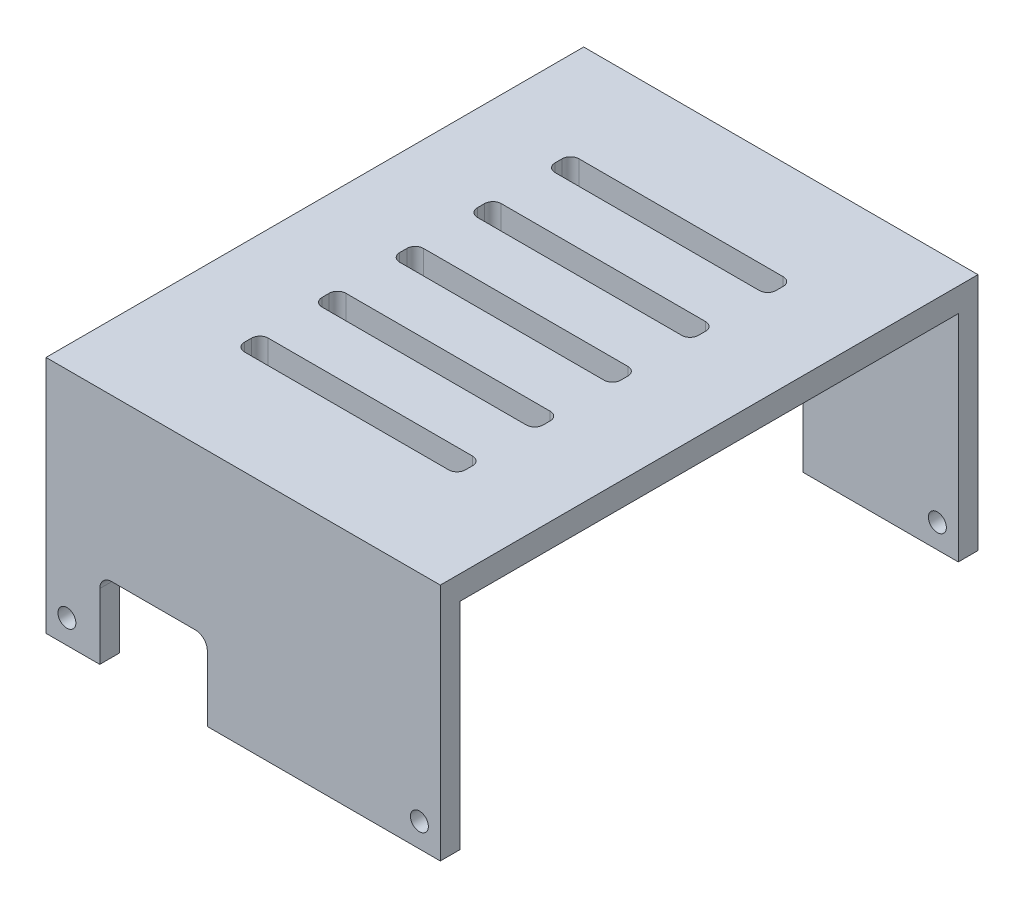
from build123d import *

# Parameters (mm, degrees)
SKETCH1_W           = 66
SKETCH1_H           = 4
BOSS_EXTRUDE1_DEPTH = 90
SKETCH2_W           = 66
SKETCH2_H           = 36
BOSS_EXTRUDE2_DEPTH = 3.3
SKETCH3_W           = 66
SKETCH3_H           = 36
BOSS_EXTRUDE3_DEPTH = 3.3
SKETCH4_R           = 1.5
CUT_EXTRUDE1_DEPTH  = 104.116439039
CUT_EXTRUDE2_REACH  = 105.116
SKETCH5_W           = 18
SKETCH5_H           = 13
CUT_EXTRUDE4_REACH  = 105.116
FILLET1_R           = 2
CUT_EXTRUDE5_REACH  = 105.87
LPATTERN1_COUNT     = 5
LPATTERN1_PITCH     = 13


with BuildPart() as part:
    # Sketch1 → Boss-Extrude1 (new body)
    with BuildSketch(Plane.XY):
        Rectangle(SKETCH1_W, SKETCH1_H)
    extrude(amount=BOSS_EXTRUDE1_DEPTH)

    # Sketch2 → Boss-Extrude2 (add)
    with BuildSketch(Plane.XY.offset(90)):
        with Locations((0, -20)):
            Rectangle(SKETCH2_W, SKETCH2_H)
    extrude(amount=-BOSS_EXTRUDE2_DEPTH)

    # Sketch3 → Boss-Extrude3 (add)
    with BuildSketch(Plane(origin=(0, 0, 0), x_dir=(-1, 0, 0), z_dir=(0, 0, -1))):
        with Locations((0, -20)):
            Rectangle(SKETCH3_W, SKETCH3_H)
    extrude(amount=-BOSS_EXTRUDE3_DEPTH)

    # Sketch4 → Cut-Extrude1 (cut, through all)
    with BuildSketch(Plane.XY.offset(90)):
        with Locations((-29.5, -34)):
            Circle(SKETCH4_R)
        with Locations((29.5, -34)):
            Circle(SKETCH4_R)
    extrude(amount=-CUT_EXTRUDE1_DEPTH, mode=Mode.SUBTRACT)

    # Sketch5 → Cut-Extrude2 (cut, up to next)
    with BuildSketch(Plane.XY.offset(90), mode=Mode.PRIVATE) as cut_extrude2_sk1:
        with Locations((-15, -31.5)):
            Rectangle(SKETCH5_W, SKETCH5_H)
    cut_extrude2_tool1 = extrude(cut_extrude2_sk1.sketch, amount=-CUT_EXTRUDE2_REACH, mode=Mode.PRIVATE) & part.part
    add(cut_extrude2_tool1.solids().sort_by_distance((-15, -31.5, 90))[0], mode=Mode.SUBTRACT)

    # Sketch7 → Cut-Extrude4 (cut, up to next)
    with BuildSketch(Plane(origin=(0, 0, 0), x_dir=(-1, 0, 0), z_dir=(0, 0, -1)), mode=Mode.PRIVATE) as cut_extrude4_sk1:
        with BuildLine():
            Line((-7, -38), (23, -38))
            Line((23, -38), (23, -21))
            ThreePointArc((23, -21), (22.121320344, -18.878679656), (20, -18))
            Line((20, -18), (-4, -18))
            ThreePointArc((-4, -18), (-6.121320344, -18.878679656), (-7, -21))
            Line((-7, -21), (-7, -38))
        make_face()
    cut_extrude4_tool1 = extrude(cut_extrude4_sk1.sketch, amount=-CUT_EXTRUDE4_REACH, mode=Mode.PRIVATE) & part.part
    add(cut_extrude4_tool1.solids().sort_by_distance((-8, -28.060456, 0))[0], mode=Mode.SUBTRACT)

    # Fillet1
    fillet1_edges = [part.edges().sort_by_distance(p)[0] for p in [
        (-24, -25, 88.35),
        (-6, -25, 88.35),
    ]]
    fillet(fillet1_edges, radius=FILLET1_R)

    # Sketch8 → Cut-Extrude5 (cut, up to next)
    with BuildSketch(Plane(origin=(0, 2, 0), x_dir=(1, 0, 0), z_dir=(0, 1, 0)), mode=Mode.PRIVATE) as cut_extrude5_sk1:
        with BuildLine():
            Line((-17.2, -16.6), (17, -16.6))
            ThreePointArc((17, -16.6), (17.989949494, -17.010050506), (18.4, -18))
            Line((18.4, -18), (18.4, -19.2))
            ThreePointArc((18.4, -19.2), (17.989949494, -20.189949494), (17, -20.6))
            Line((17, -20.6), (-17.2, -20.6))
            ThreePointArc((-17.2, -20.6), (-18.189949494, -20.189949494), (-18.6, -19.2))
            Line((-18.6, -19.2), (-18.6, -18))
            ThreePointArc((-18.6, -18), (-18.189949494, -17.010050506), (-17.2, -16.6))
        make_face()
    cut_extrude5_tool1 = extrude(cut_extrude5_sk1.sketch, amount=-CUT_EXTRUDE5_REACH, mode=Mode.PRIVATE) & part.part
    cut_extrude5 = cut_extrude5_tool1.solids().sort_by_distance((-0.1, 2, 18.6))[0]
    add(cut_extrude5, mode=Mode.SUBTRACT)

    # LPattern1: Cut-Extrude5 ×5
    with Locations(*[(0, 0, i * LPATTERN1_PITCH) for i in range(1, LPATTERN1_COUNT)]):
        add(cut_extrude5, mode=Mode.SUBTRACT)


solid = part.part
